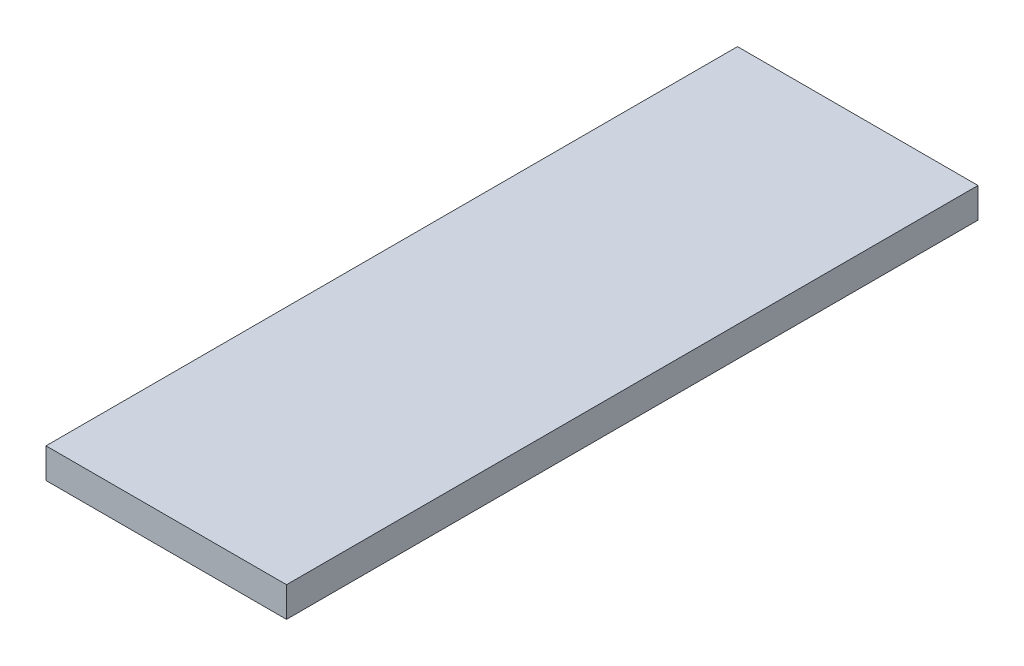
from build123d import *

# Parameters (mm, degrees)
SKETCH1_W           = 304.8
SKETCH1_H           = 304.8
BOSS_EXTRUDE1_DEPTH = 6.35
CUT_EXTRUDE2_DEPTH  = 6.35


with BuildPart() as part:
    # Sketch1 → Boss-Extrude1 (new body)
    with BuildSketch(Plane(origin=(0, 0, 0), x_dir=(1, 0, 0), z_dir=(0, 1, 0))):
        with Locations((152.4, 152.4)):
            Rectangle(SKETCH1_W, SKETCH1_H)
    extrude(amount=BOSS_EXTRUDE1_DEPTH)

    # Sketch2 → Cut-Extrude2 (cut)
    with BuildSketch(Plane(origin=(0, 6.35, 0), x_dir=(1, 0, 0), z_dir=(0, 1, 0))):
        Polygon((50.8, 304.8), (50.8, 158.75), (0, 158.75), (0, 0), (304.8, 0), (304.8, 304.8), align=None)
    extrude(amount=-CUT_EXTRUDE2_DEPTH, mode=Mode.SUBTRACT)


solid = part.part
